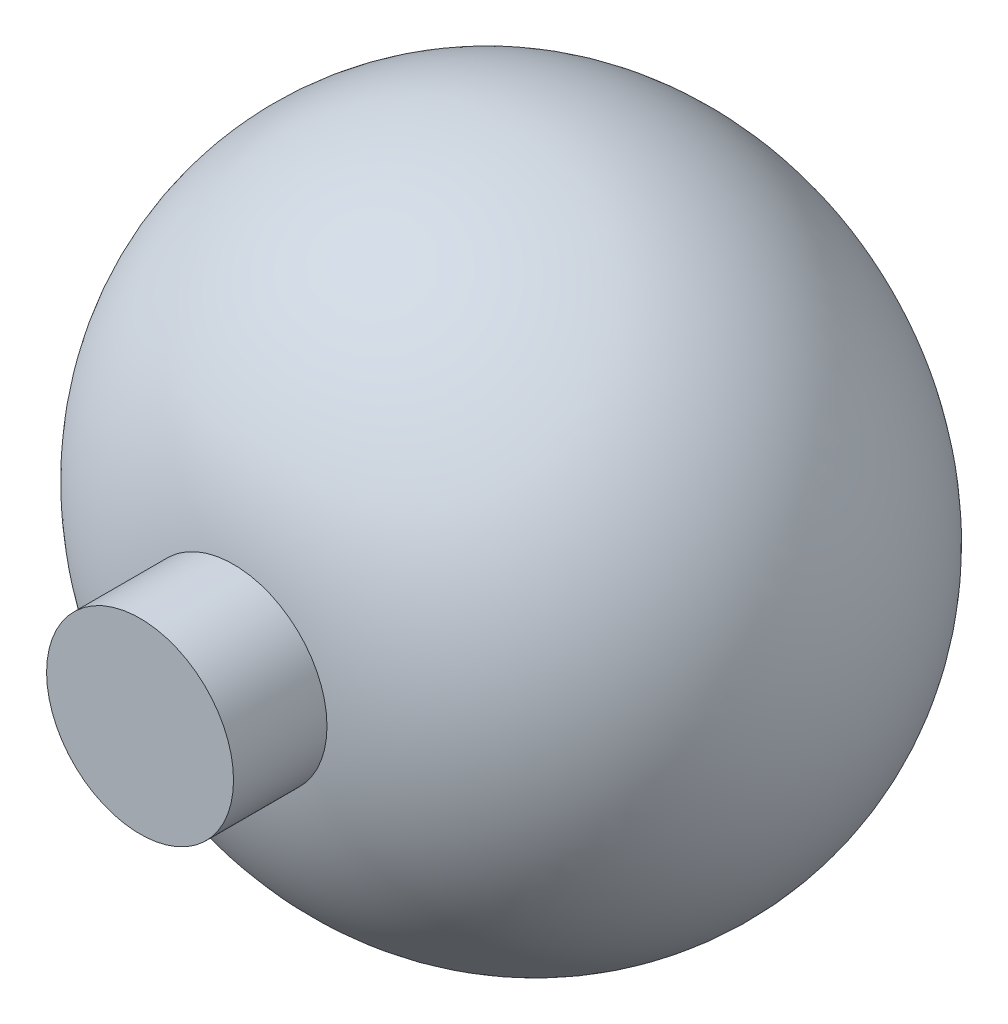
from build123d import *


with BuildPart() as part:
    # Sketch1 → Revolve1 (revolve)
    with BuildSketch(Plane(origin=(0, 0, 0), x_dir=(1, 0, 0), z_dir=(0, 1, 0))):
        with BuildLine():
            Line((0, 34.699345893), (0, 0))
            Line((0, 0), (-5, 0))
            Line((-5, 0), (-5, 5))
            ThreePointArc((-5, 5), (-17.881695634, 19.849672946), (-5, 34.699345893))
            Line((-5, 34.699345893), (0, 34.699345893))
        make_face()
    revolve(axis=Axis((0, 0, -34.699345893), (0, 0, 1)))


solid = part.part
